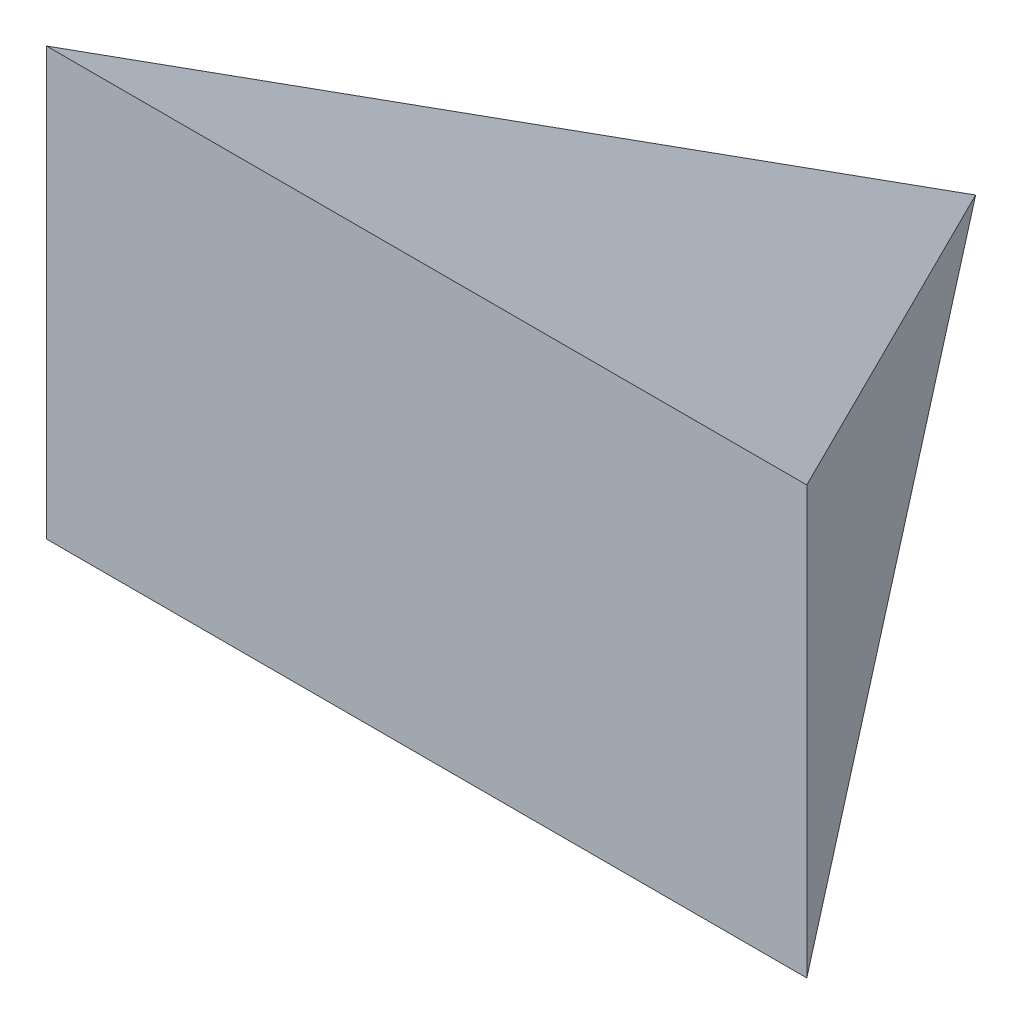
from build123d import *

# Parameters (mm, degrees)
SKETCH1_W               = 12.8
SKETCH1_H               = 7.2
BOSS_EXTRUDE1_DEPTH     = 10000
BOSS_EXTRUDE1_TAPER     = -34.7
CUT_EXTRUDE1_DEPTH      = 14018.158712552
CUT_EXTRUDE1_DEPTH_BACK = 14018.158712552


with BuildPart() as part:
    # Sketch1 → Boss-Extrude1 (new body)
    with BuildSketch(Plane.XY.offset(-0.1)):
        with Locations((32.5, 0)):
            Rectangle(SKETCH1_W, SKETCH1_H)
    extrude(amount=BOSS_EXTRUDE1_DEPTH, taper=BOSS_EXTRUDE1_TAPER)

    # Sketch2 → Cut-Extrude1 (cut, two sides: drawn at the far end of the back side and taken through both)
    with BuildSketch(Plane(origin=(0, 0, 0), x_dir=(0, 0, -1), z_dir=(1, 0, 0)).offset(-CUT_EXTRUDE1_DEPTH_BACK)):
        Polygon((0.1, 3.6), (0.1, -3.6), (-58862.10505337, -22893.859655225), (-798.767224137, -29978.123240602), (17319.323007579, 20158.848684987), (-60605.398834857, 23571.789530217), align=None)
    extrude(amount=CUT_EXTRUDE1_DEPTH + CUT_EXTRUDE1_DEPTH_BACK, mode=Mode.SUBTRACT)


solid = part.part
